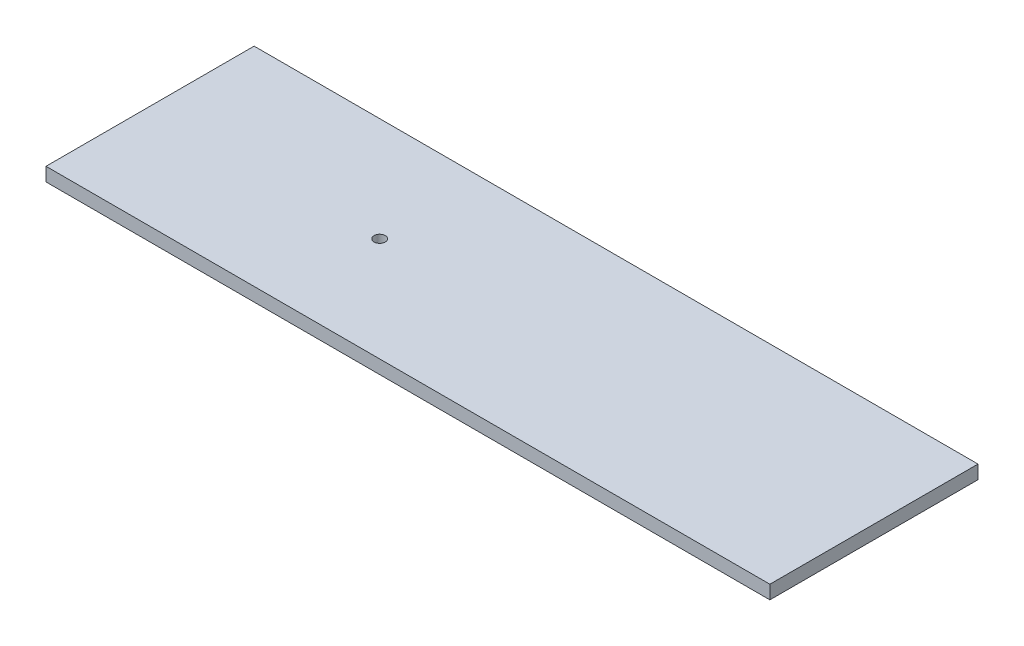
from build123d import *

# Parameters (mm, degrees)
SKETCH1_W           = 40
SKETCH1_H           = 11.5
BOSS_EXTRUDE1_DEPTH = 0.375
SCALE1_SCALE        = 10
SKETCH2_R           = 3.1
CUT_EXTRUDE1_DEPTH  = 209.23664423


with BuildPart() as part:
    # Sketch1 → Boss-Extrude1 (new, symmetric)
    with BuildSketch(Plane(origin=(0, 0, 0), x_dir=(1, 0, 0), z_dir=(0, 1, 0))):
        Rectangle(SKETCH1_W, SKETCH1_H)
    extrude(amount=BOSS_EXTRUDE1_DEPTH, both=True)


with BuildPart() as part_1:
    # Scale1: scaled about (0, 0, 0)
    add(part.part.scale(SCALE1_SCALE))

    # Sketch2 → Cut-Extrude1 (cut, through all)
    with BuildSketch(Plane(origin=(0, 3.75, 0), x_dir=(1, 0, 0), z_dir=(0, 1, 0))):
        with Locations(Location((-73.1, 0, 0), (0, 0, 270))):
            Circle(SKETCH2_R)
    extrude(amount=-CUT_EXTRUDE1_DEPTH, mode=Mode.SUBTRACT)


solid = part_1.part
